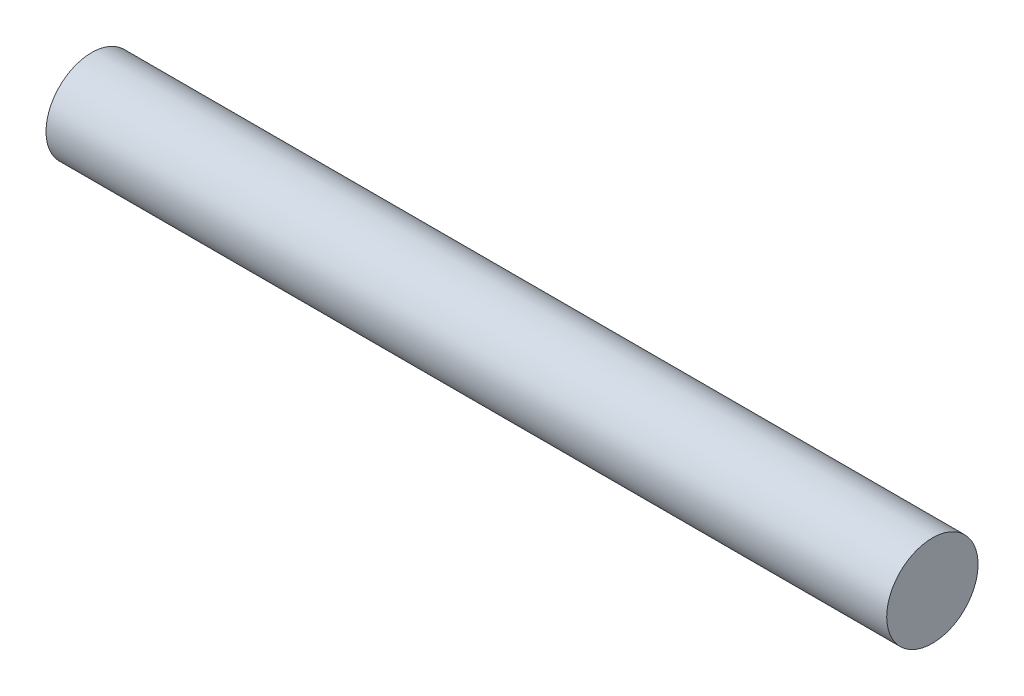
from build123d import *

# Parameters (mm, degrees)
SKETCH_1_W = 184
SKETCH_1_H = 10


with BuildPart() as part:
    # 草图1 → 旋转1 (revolve)
    with BuildSketch(Plane(origin=(0, 0, 0), x_dir=(1, 0, 0), z_dir=(0, 1, 0)), mode=Mode.PRIVATE) as revolve_1_sk:
        with Locations((92, 5)):
            Rectangle(SKETCH_1_W, SKETCH_1_H)
    revolve(revolve_1_sk.sketch.rotate(Axis((-1000, 0, 0), (1, 0, 0)), 180), axis=Axis((-1000, 0, 0), (1, 0, 0)))


solid = part.part
